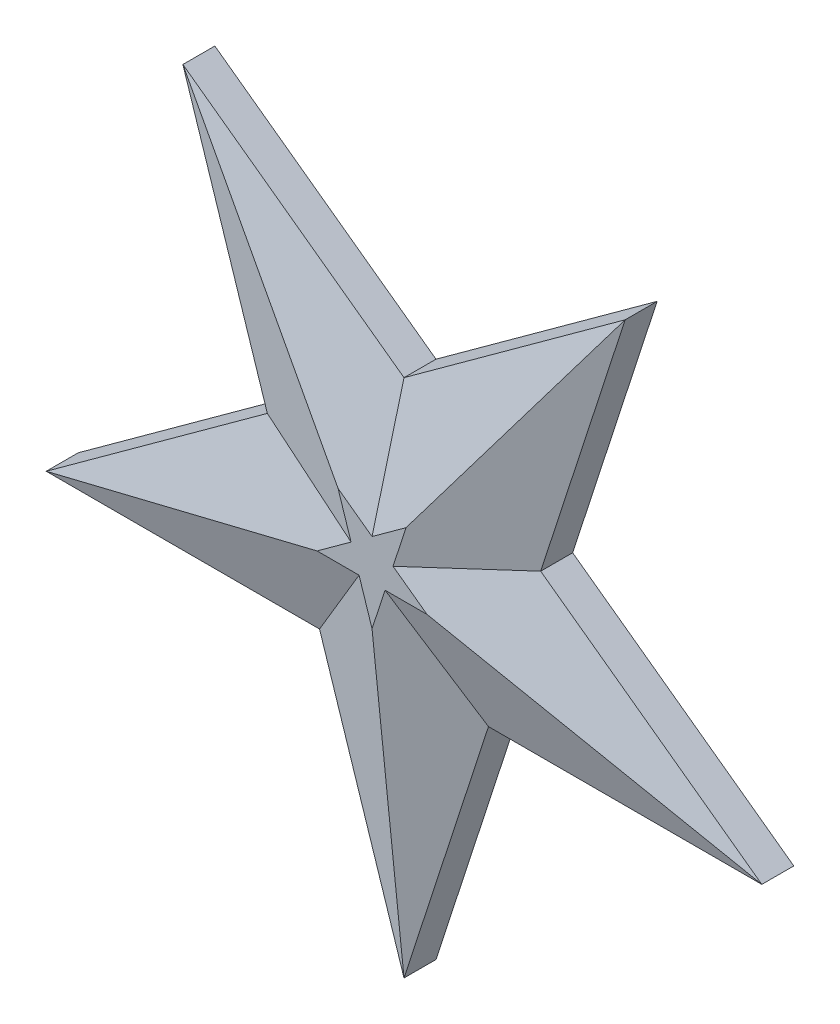
from build123d import *

# Parameters (mm, degrees)
SALIENTE_EXTRUIR1_DEPTH = 2
SALIENTE_EXTRUIR2_DEPTH = 2
SALIENTE_EXTRUIR2_DRAFT = 72


with BuildPart() as part:
    # Croquis1 → Saliente-Extruir1 (new body)
    with BuildSketch(Plane.XY):
        Polygon((-6.350280368, -35.236671251), (-11.634129822, -18.974654774), (-28.733025837, -18.974654774), (-14.899728375, -8.924175866), (-20.183577829, 7.337840611), (-6.350280368, -2.712638297), (7.483017094, 7.337840611), (2.19916764, -8.924175866), (16.032465101, -18.974654774), (-1.066430914, -18.974654774), align=None)
    extrude(amount=SALIENTE_EXTRUIR1_DEPTH)


with BuildPart() as saliente_extruir2_tool:
    # Croquis2 → Saliente-Extruir2 (with draft: the straight prism first)
    with BuildSketch(Plane.XY.offset(2)):
        Polygon((-14.899728375, -8.924175866), (-28.733025837, -18.974654774), (-11.634129822, -18.974654774), (-6.350280368, -35.236671251), (-1.066430914, -18.974654774), (16.032465101, -18.974654774), (2.19916764, -8.924175866), (7.483017094, 7.337840611), (-6.350280368, -2.712638297), (-20.183577829, 7.337840611), align=None)
    extrude(amount=SALIENTE_EXTRUIR2_DEPTH)
    # Saliente-Extruir2: the draft: its side faces are tilted about the plane it starts from
    saliente_extruir2_sides = [saliente_extruir2_tool.faces().sort_by_distance(p)[0] for p in [
        (-17.541653102, -0.793167627, 3),
        (-21.816377106, -13.94941532, 3),
        (-20.183577829, -18.974654774, 3),
        (-8.992205095, -27.105663013, 3),
        (-3.708355641, -27.105663013, 3),
        (7.483017094, -18.974654774, 3),
        (9.115816371, -13.94941532, 3),
        (4.841092367, -0.793167627, 3),
        (0.566368363, 2.312601157, 3),
        (-13.266929099, 2.312601157, 3),
    ]]
    draft(saliente_extruir2_sides, Plane.XY.offset(2), SALIENTE_EXTRUIR2_DRAFT)


with BuildPart() as part_1:
    add(part.part)

    # Saliente-Extruir2: add saliente_extruir2_tool
    add(saliente_extruir2_tool.part)


solid = part_1.part
